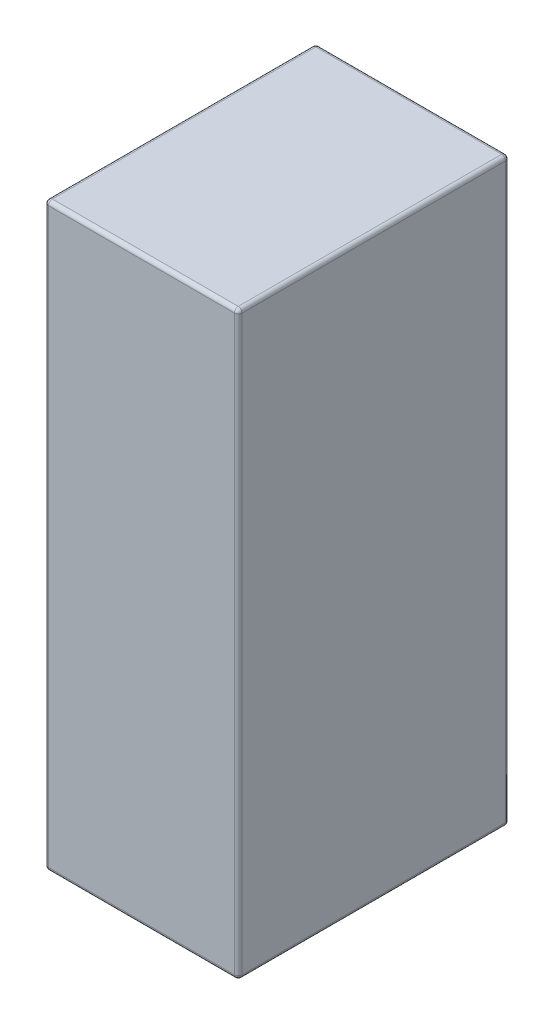
from build123d import *

# Parameters (mm, degrees)
SKETCH1_W           = 50
SKETCH1_H           = 70
BOSS_EXTRUDE1_DEPTH = 75
FILLET1_R           = 1


with BuildPart() as part:
    # Sketch1 → Boss-Extrude1 (new, symmetric)
    with BuildSketch(Plane(origin=(0, 0, 0), x_dir=(1, 0, 0), z_dir=(0, 1, 0))):
        Rectangle(SKETCH1_W, SKETCH1_H)
    extrude(amount=BOSS_EXTRUDE1_DEPTH, both=True)

    # Fillet1
    fillet1_edges = [part.edges().sort_by_distance(p)[0] for p in [
        (-25, 75, 0),
        (0, 75, 35),
        (25, 75, 0),
        (0, -75, 35),
        (-25, -75, 0),
        (0, -75, -35),
        (25, -75, 0),
        (0, 75, -35),
        (25, 0, 35),
        (-25, 0, 35),
        (-25, 0, -35),
        (25, 0, -35),
    ]]
    fillet(fillet1_edges, radius=FILLET1_R)


solid = part.part
